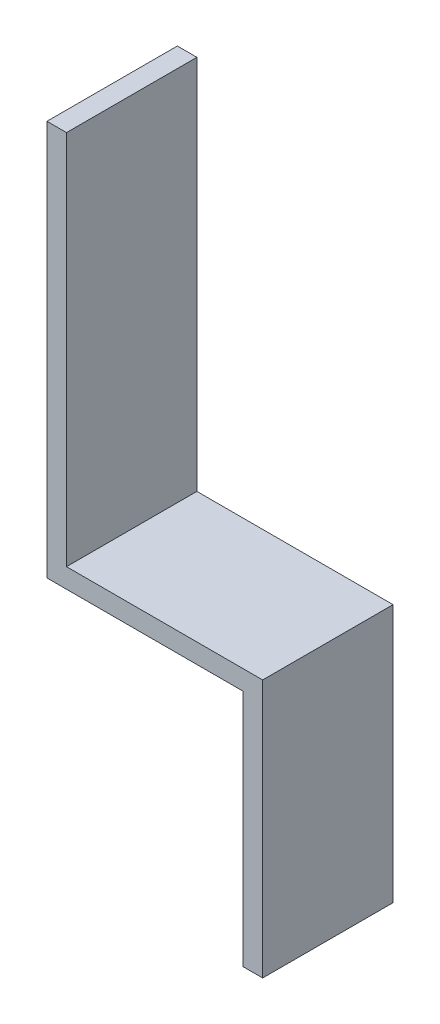
from build123d import *

# Parameters (mm, degrees)
BOSS_EXTRUDE1_DEPTH = 20


with BuildPart() as part:
    # Sketch1 → Boss-Extrude1 (new body)
    with BuildSketch(Plane.XY):
        Polygon((-3, -15.109731251), (-3, -51.701242251), (0, -51.701242251), (0, -12.109731251), (-30.084538342, -12.109731251), (-30.084538342, 45.550406665), (-33.084538342, 45.550406665), (-33.084538342, -15.109731251), align=None)
    extrude(amount=BOSS_EXTRUDE1_DEPTH)


solid = part.part
